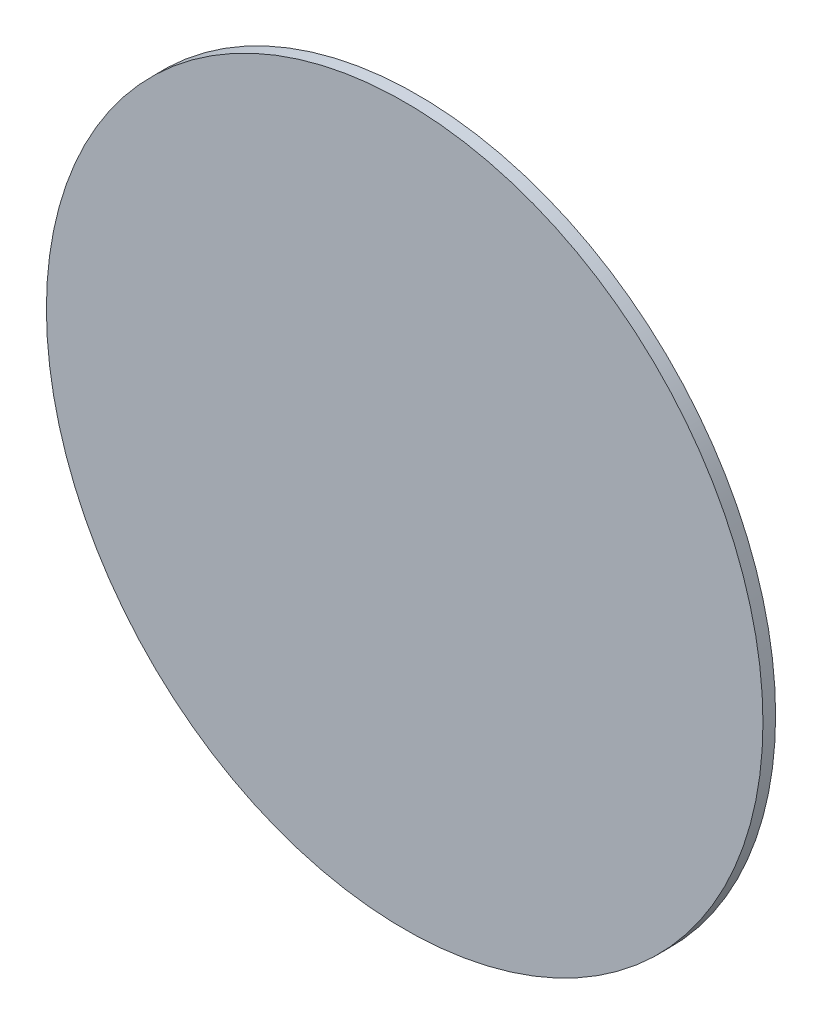
from build123d import *

# Parameters (mm, degrees)
SKETCH1_R           = 90
BOSS_EXTRUDE1_DEPTH = 3.175


with BuildPart() as part:
    # Sketch1 → Boss-Extrude1 (new body)
    with BuildSketch(Plane.XY):
        Circle(SKETCH1_R)
    extrude(amount=BOSS_EXTRUDE1_DEPTH)


solid = part.part
